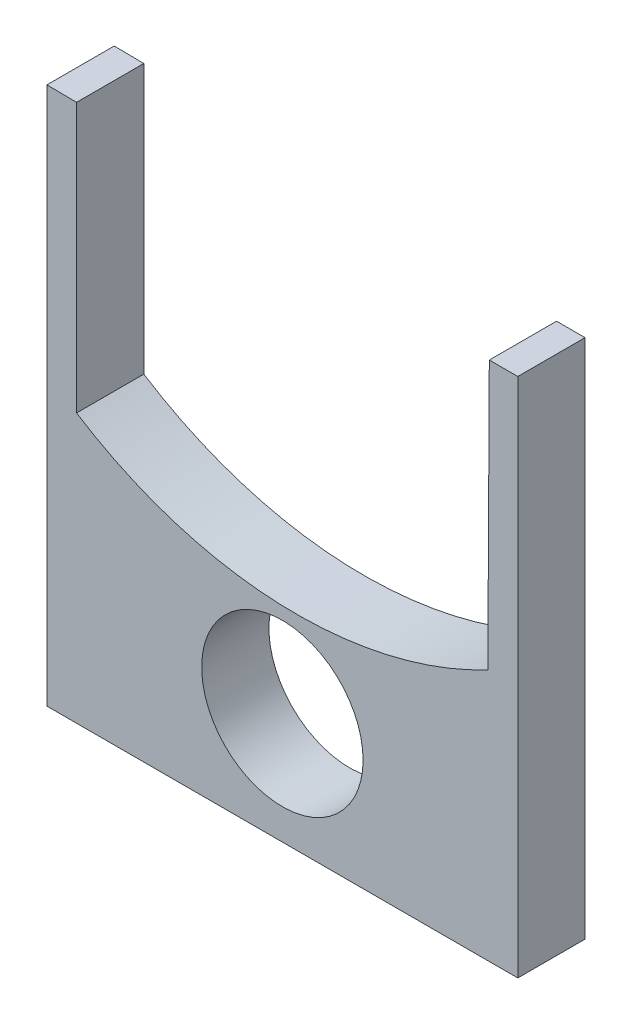
from build123d import *

# Parameters (mm, degrees)
SKETCH1_R           = 6
BOSS_EXTRUDE1_DEPTH = 5


with BuildPart() as part:
    # Sketch1 → Boss-Extrude1 (new body)
    with BuildSketch(Plane.XY):
        with BuildLine():
            Line((-17.5, 13.936040182), (-15.300145315, 13.910754496))
            Line((-15.300145315, 13.910754496), (-15.300145315, -6.089245504))
            ThreePointArc((-15.300145315, -6.089245504), (-0.182449411, -10.840989572), (15.272527887, -7.338493622))
            Line((15.272527887, -7.338493622), (15.382416338, 12.661204489))
            Line((15.382416338, 12.661204489), (17.5, 12.661204489))
            Line((17.5, 12.661204489), (17.5, -26.063959818))
            Line((17.5, -26.063959818), (-17.5, -26.063959818))
            Line((-17.5, -26.063959818), (-17.5, 13.936040182))
        make_face()
        with Locations((0, -17.7864885)):
            Circle(SKETCH1_R, mode=Mode.SUBTRACT)
    extrude(amount=BOSS_EXTRUDE1_DEPTH)


solid = part.part
